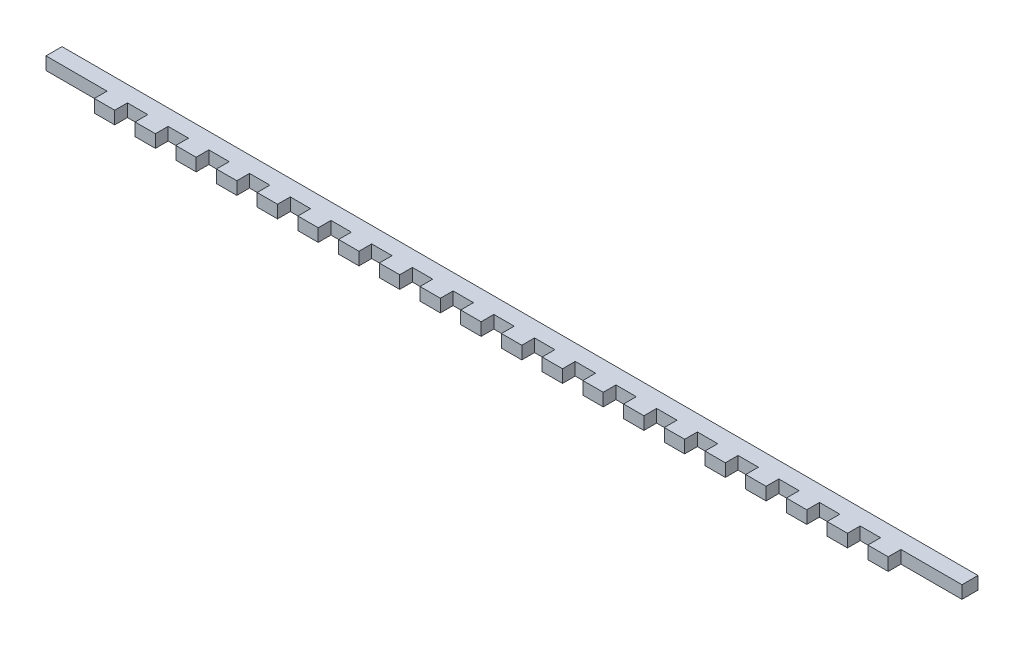
from build123d import *

# Parameters (mm, degrees)
BOSS_EXTRUDE1_DEPTH = 3.175


with BuildPart() as part:
    # Sketch1 → Boss-Extrude1 (new body)
    with BuildSketch(Plane(origin=(0, 0, 0), x_dir=(1, 0, 0), z_dir=(0, 1, 0))):
        Polygon((-171.335820364, 2.060946796), (-156.095820364, 2.060946796), (-156.095820364, -1.114053204), (-151.015820364, -1.114053204), (-151.015820364, 2.060946796), (-145.935820364, 2.060946796), (-145.935820364, -1.114053204), (-140.855820364, -1.114053204), (-140.855820364, 2.060946796), (-135.775820364, 2.060946796), (-135.775820364, -1.114053204), (-130.695820364, -1.114053204), (-130.695820364, 2.060946796), (-125.615820364, 2.060946796), (-125.615820364, -1.114053204), (-120.535820364, -1.114053204), (-120.535820364, 2.060946796), (-115.455820364, 2.060946796), (-115.455820364, -1.114053204), (-110.375820364, -1.114053204), (-110.375820364, 2.060946796), (-105.295820364, 2.060946796), (-105.295820364, -1.114053204), (-100.215820364, -1.114053204), (-100.215820364, 2.060946796), (-95.135820364, 2.060946796), (-95.135820364, -1.114053204), (-90.055820364, -1.114053204), (-90.055820364, 2.060946796), (-84.975820364, 2.060946796), (-84.975820364, -1.114053204), (-79.895820364, -1.114053204), (-79.895820364, 2.060946796), (-74.815820364, 2.060946796), (-74.815820364, -1.114053204), (-69.735820364, -1.114053204), (-69.735820364, 2.060946796), (-64.655820364, 2.060946796), (-64.655820364, -1.114053204), (-59.575820364, -1.114053204), (-59.575820364, 2.060946796), (-54.495820364, 2.060946796), (-54.495820364, -1.114053204), (-49.415820364, -1.114053204), (-49.415820364, 2.060946796), (-44.335820364, 2.060946796), (-44.335820364, -1.114053204), (-39.255820364, -1.114053204), (-39.255820364, 2.060946796), (-34.175820364, 2.060946796), (-34.175820364, -1.114053204), (-29.095820364, -1.114053204), (-29.095820364, 2.060946796), (-24.015820364, 2.060946796), (-24.015820364, -1.114053204), (-18.935820364, -1.114053204), (-18.935820364, 2.060946796), (-13.855820364, 2.060946796), (-13.855820364, -1.114053204), (-8.775820364, -1.114053204), (-8.775820364, 2.060946796), (-3.695820364, 2.060946796), (-3.695820364, -1.114053204), (1.384179636, -1.114053204), (1.384179636, 2.060946796), (6.464179636, 2.060946796), (6.464179636, -1.114053204), (11.544179636, -1.114053204), (11.544179636, 2.060946796), (16.624179636, 2.060946796), (16.624179636, -1.114053204), (21.704179636, -1.114053204), (21.704179636, 2.060946796), (26.784179636, 2.060946796), (26.784179636, -1.114053204), (31.864179636, -1.114053204), (31.864179636, 2.060946796), (36.944179636, 2.060946796), (36.944179636, -1.114053204), (42.024179636, -1.114053204), (42.024179636, 2.060946796), (57.264179636, 2.060946796), (57.264179636, 6.060946796), (-171.335820364, 6.060946796), align=None)
    extrude(amount=BOSS_EXTRUDE1_DEPTH)


solid = part.part
